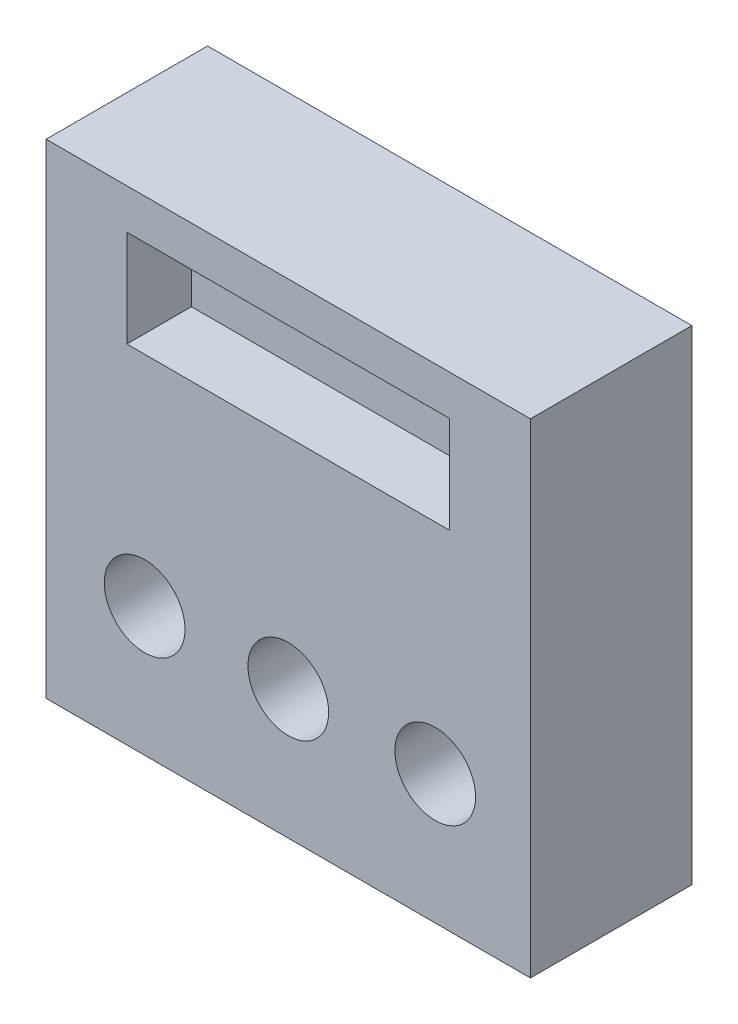
from build123d import *

# Parameters (mm, degrees)
ESBO_O1_W                = 150
ESBO_O1_H                = 150
RESSALTO_EXTRUS_O1_DEPTH = 50
ESBO_O2_W                = 100
ESBO_O2_H                = 30
CORTE_EXTRUS_O1_DEPTH    = 20
ESBO_O3_R                = 12.5
CORTE_EXTRUS_O2_DEPTH    = 45


with BuildPart() as part:
    # Esboço1 → Ressalto-extrusão1 (new body)
    with BuildSketch(Plane.XY):
        Rectangle(ESBO_O1_W, ESBO_O1_H)
    extrude(amount=RESSALTO_EXTRUS_O1_DEPTH)

    # Esboço2 → Corte-extrusão1 (cut)
    with BuildSketch(Plane.XY.offset(50)):
        with Locations((0, 47.564970211)):
            Rectangle(ESBO_O2_W, ESBO_O2_H)
    extrude(amount=-CORTE_EXTRUS_O1_DEPTH, mode=Mode.SUBTRACT)

    # Esboço3 → Corte-extrusão2 (cut)
    with BuildSketch(Plane.XY.offset(50)):
        with Locations((-44.493882085, -35)):
            Circle(ESBO_O3_R)
        with Locations((0, -35)):
            Circle(ESBO_O3_R)
        with Locations((45.506117915, -35)):
            Circle(ESBO_O3_R)
    extrude(amount=-CORTE_EXTRUS_O2_DEPTH, mode=Mode.SUBTRACT)


solid = part.part
